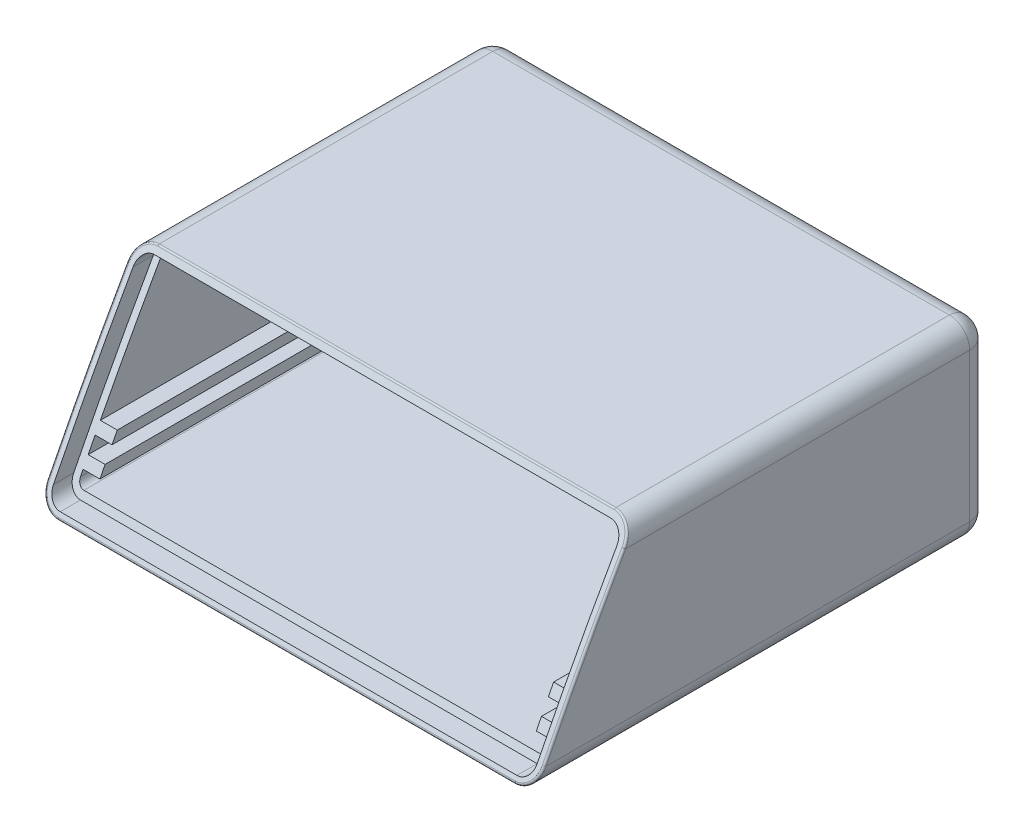
from build123d import *

# Parameters (mm, degrees)
SKETCH1_W                = 73.58
SKETCH1_H                = 67.5
BOSS_EXTRUDE1_DEPTH      = 28
FILLET1_R                = 3
SHELL1_T                 = -2
CUT_EXTRUDE1_DEPTH       = 86.656750464
FILLET2_R                = 3
CUT_EXTRUDE3_REACH       = 162.173
CUT_EXTRUDE3_END_RADIUS  = 475
CUT_EXTRUDE3_START       = 80
FILLET3_R                = 0.3
BOSS_EXTRUDE2_REACH      = 82.024
BOSS_EXTRUDE2_END_RADIUS = 475
SKETCH5_W                = 2.5
SKETCH5_H                = 1.5
SKETCH6_W                = 14.3
SKETCH6_H                = 16.7
SKETCH6_W_2              = 11.05
SKETCH6_H_2              = 14.049996967
CUT_EXTRUDE4_DEPTH       = 2


with BuildPart() as part:
    # Sketch1 → Boss-Extrude1 (new body)
    with BuildSketch(Plane(origin=(0, 0, 0), x_dir=(1, 0, 0), z_dir=(0, 1, 0))):
        Rectangle(SKETCH1_W, SKETCH1_H)
    extrude(amount=BOSS_EXTRUDE1_DEPTH)

    # Fillet1
    fillet1_edges = [part.edges().sort_by_distance(p)[0] for p in [
        (-36.79, 28, 0),
        (36.79, 28, 0),
        (-36.79, 0, 0),
        (36.79, 0, 0),
    ]]
    fillet(fillet1_edges, radius=FILLET1_R)

    # Shell1
    shell1_openings = [part.faces().sort_by_distance(p)[0] for p in [
        (0, 14, 33.75),
    ]]
    offset(amount=SHELL1_T, openings=shell1_openings, kind=Kind.INTERSECTION)

    # Sketch2 → Cut-Extrude1 (cut, through all)
    with BuildSketch(Plane.ZY.offset(36.79)):
        with BuildLine():
            Line((18.75, 28), (33.75, 28))
            Line((33.75, 28), (33.75, 0))
            ThreePointArc((33.75, 0), (26.484121584, 14.125422277), (18.75, 28))
        make_face()
    extrude(amount=-CUT_EXTRUDE1_DEPTH, mode=Mode.SUBTRACT)

    # Fillet2
    fillet2_edges = [part.edges().sort_by_distance(p)[0] for p in [
        (0, 28, -33.75),
        (0, 0, -33.75),
        (-36.79, 14, -33.75),
        (36.79, 14, -33.75),
        (-35.911320344, 27.121320344, -33.75),
        (-35.911320344, 0.878679656, -33.75),
        (35.911320344, 0.878679656, -33.75),
        (35.911320344, 27.121320344, -33.75),
    ]]
    fillet(fillet2_edges, radius=FILLET2_R)

    # Cut-Extrude3: up to this cylinder (the profile starts outside it)
    cut_extrude3_end = Plane(origin=(0, -210.179748667, -395.218864179), z_dir=(-1, 0, 0)) * Cylinder(CUT_EXTRUDE3_END_RADIUS, 1275.346, mode=Mode.PRIVATE)
    # Sketch4 → Cut-Extrude3 (cut, up to the surface)
    with BuildSketch(Plane.XY.offset(-31.75).offset(CUT_EXTRUDE3_START), mode=Mode.PRIVATE) as cut_extrude3_sk1:
        with BuildLine():
            Line((33.79, 27), (-33.79, 27))
            ThreePointArc((-33.79, 27), (-35.204213562, 26.414213562), (-35.79, 25))
            Line((-35.79, 25), (-35.79, 3))
            ThreePointArc((-35.79, 3), (-35.204213562, 1.585786438), (-33.79, 1))
            Line((-33.79, 1), (33.79, 1))
            ThreePointArc((33.79, 1), (35.204213562, 1.585786438), (35.79, 3))
            Line((35.79, 3), (35.79, 25))
            ThreePointArc((35.79, 25), (35.204213562, 26.414213562), (33.79, 27))
        make_face()
        with BuildLine():
            Line((33.79, 26), (-33.79, 26))
            ThreePointArc((-33.79, 26), (-34.497106781, 25.707106781), (-34.79, 25))
            Line((-34.79, 25), (-34.79, 3))
            ThreePointArc((-34.79, 3), (-34.497106781, 2.292893219), (-33.79, 2))
            Line((-33.79, 2), (33.79, 2))
            ThreePointArc((33.79, 2), (34.497106781, 2.292893219), (34.79, 3))
            Line((34.79, 3), (34.79, 25))
            ThreePointArc((34.79, 25), (34.497106781, 25.707106781), (33.79, 26))
        make_face(mode=Mode.SUBTRACT)
    cut_extrude3_tool1 = extrude(cut_extrude3_sk1.sketch, amount=-CUT_EXTRUDE3_REACH, mode=Mode.PRIVATE) - cut_extrude3_end
    add(cut_extrude3_tool1.solids().sort_by_distance((0, 26.238443, 48.25))[0], mode=Mode.SUBTRACT)

    # Fillet3
    fillet3_edges = [part.edges().sort_by_distance(p)[0] for p in [
        (0, 0, 33.75),
        (-36.79, 14.077394683, 26.509847108),
        (35.984331752, 27.045704827, 19.301590008),
        (35.969562436, 0.938566613, 33.285609296),
        (-35.969562436, 0.938566613, 33.285609296),
        (-35.984331752, 27.045704827, 19.301590008),
        (36.79, 14.077394683, 26.509847108),
        (0, 28, 18.75),
    ]]
    fillet(fillet3_edges, radius=FILLET3_R)

    # Boss-Extrude2: up to this cylinder (the profile starts inside it)
    boss_extrude2_end = Plane(origin=(0, -210.179748667, -395.218864179), z_dir=(-1, 0, 0)) * Cylinder(BOSS_EXTRUDE2_END_RADIUS, 1182.128, mode=Mode.PRIVATE)
    # Sketch5 → Boss-Extrude2 (add, up to the surface)
    with BuildSketch(Plane.XY.offset(-31.75), mode=Mode.PRIVATE) as boss_extrude2_sk1:
        with Locations((33.54, 4.5)):
            Rectangle(SKETCH5_W, SKETCH5_H)
    boss_extrude2_tool1 = extrude(boss_extrude2_sk1.sketch, amount=BOSS_EXTRUDE2_REACH, mode=Mode.PRIVATE) & boss_extrude2_end
    add(boss_extrude2_tool1.solids().sort_by_distance((33.54, 4.5, -31.75))[0])
    # Sketch5 → Boss-Extrude2 (add, up to the surface)
    with BuildSketch(Plane.XY.offset(-31.75), mode=Mode.PRIVATE) as boss_extrude2_sk2:
        with Locations((33.54, 8)):
            Rectangle(SKETCH5_W, SKETCH5_H)
    boss_extrude2_tool2 = extrude(boss_extrude2_sk2.sketch, amount=BOSS_EXTRUDE2_REACH, mode=Mode.PRIVATE) & boss_extrude2_end
    add(boss_extrude2_tool2.solids().sort_by_distance((33.54, 8, -31.75))[0])
    # Sketch5 → Boss-Extrude2 (add, up to the surface)
    with BuildSketch(Plane.XY.offset(-31.75), mode=Mode.PRIVATE) as boss_extrude2_sk3:
        with Locations((-33.54, 8)):
            Rectangle(SKETCH5_W, SKETCH5_H)
    boss_extrude2_tool3 = extrude(boss_extrude2_sk3.sketch, amount=BOSS_EXTRUDE2_REACH, mode=Mode.PRIVATE) & boss_extrude2_end
    add(boss_extrude2_tool3.solids().sort_by_distance((-33.54, 8, -31.75))[0])
    # Sketch5 → Boss-Extrude2 (add, up to the surface)
    with BuildSketch(Plane.XY.offset(-31.75), mode=Mode.PRIVATE) as boss_extrude2_sk4:
        with Locations((-33.54, 4.5)):
            Rectangle(SKETCH5_W, SKETCH5_H)
    boss_extrude2_tool4 = extrude(boss_extrude2_sk4.sketch, amount=BOSS_EXTRUDE2_REACH, mode=Mode.PRIVATE) & boss_extrude2_end
    add(boss_extrude2_tool4.solids().sort_by_distance((-33.54, 4.5, -31.75))[0])

    # Sketch6 → Cut-Extrude4 (cut)
    with BuildSketch(Plane(origin=(0, 0, -33.75), x_dir=(-1, 0, 0), z_dir=(0, 0, -1))):
        with Locations((0, 10.35)):
            Rectangle(SKETCH6_W, SKETCH6_H)
        with Locations((26.425, 10.175001517)):
            Rectangle(SKETCH6_W_2, SKETCH6_H_2)
    extrude(amount=-CUT_EXTRUDE4_DEPTH, mode=Mode.SUBTRACT)


solid = part.part
